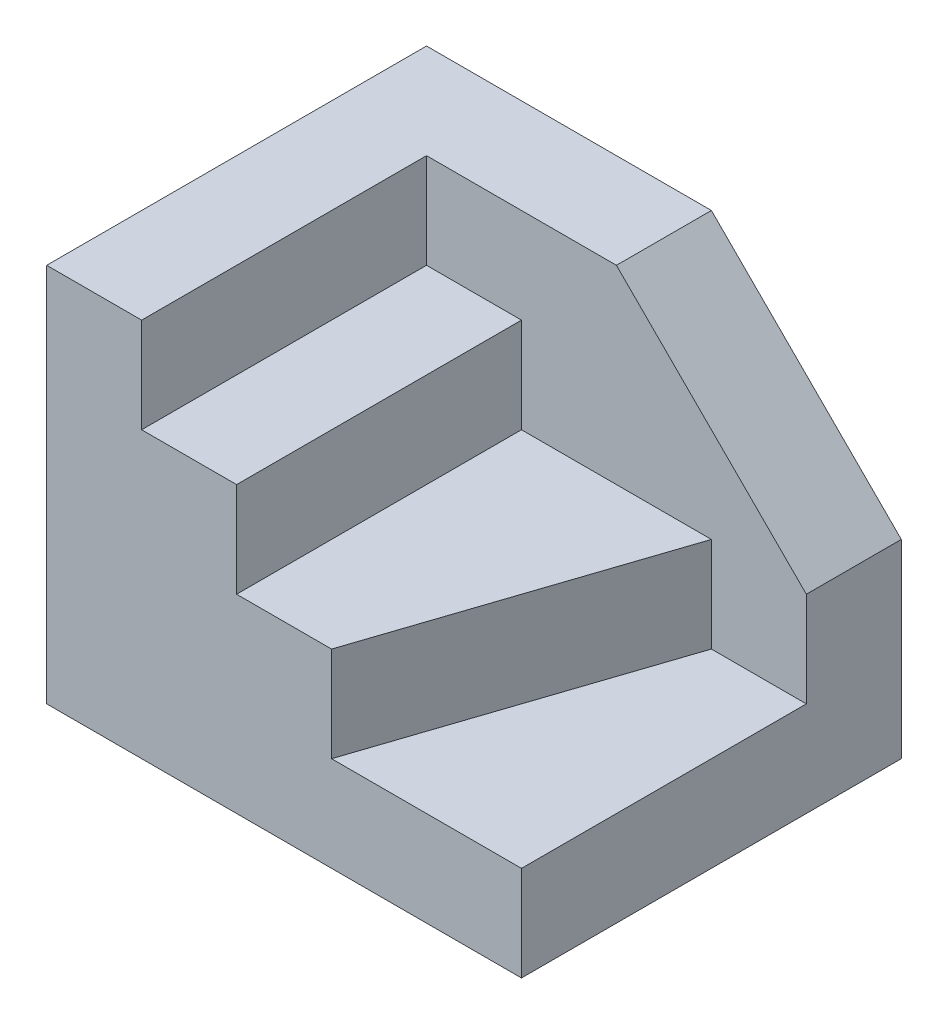
from build123d import *

# Parameters (mm, degrees)
BOSS_EXTRUDE1_DEPTH = 30
CUT_EXTRUDE1_DEPTH  = 10
BOSS_EXTRUDE2_DEPTH = 10


with BuildPart() as part:
    # Sketch1 → Boss-Extrude1 (new body)
    with BuildSketch(Plane.XY):
        Polygon((-20, 26.481481481), (-20, -13.518518519), (30, -13.518518519), (30, -3.518518519), (20, -3.518518519), (20, 6.481481481), (0, 6.481481481), (0, 16.481481481), (-10, 16.481481481), (-10, 26.481481481), align=None)
    extrude(amount=BOSS_EXTRUDE1_DEPTH)

    # Sketch2 → Cut-Extrude1 (cut)
    with BuildSketch(Plane(origin=(0, 6.481481481, 0), x_dir=(1, 0, 0), z_dir=(0, 1, 0))):
        Polygon((20, 0), (10, -30), (20, -30), align=None)
    extrude(amount=-CUT_EXTRUDE1_DEPTH, mode=Mode.SUBTRACT)

    # Sketch3 → Boss-Extrude2 (add)
    with BuildSketch(Plane(origin=(0, 0, 0), x_dir=(-1, 0, 0), z_dir=(0, 0, -1))):
        Polygon((20, 26.481481481), (20, -13.518518519), (-30, -13.518518519), (-30, 6.481481481), (-10, 26.481481481), align=None)
    extrude(amount=BOSS_EXTRUDE2_DEPTH)


solid = part.part
